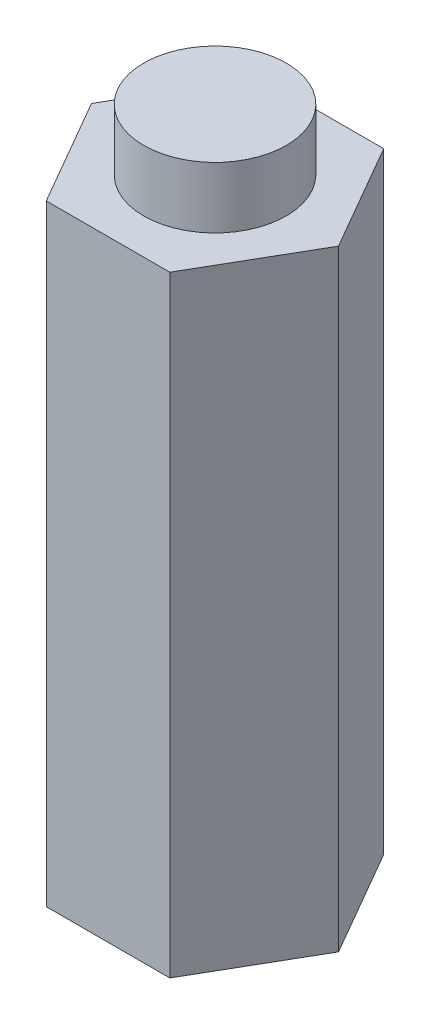
from build123d import *

# Parameters (mm, degrees)
DODANIE_WYCI_GNI_CIE1_DEPTH = 60
SZKIC2_R                    = 7
DODANIE_WYCI_GNI_CIE2_DEPTH = 6


with BuildPart() as part:
    # Szkic1 → Dodanie-wyciągnięcie1 (new body)
    with BuildSketch(Plane(origin=(0, 0, 0), x_dir=(1, 0, 0), z_dir=(0, 1, 0))):
        Polygon((12.124355653, 0), (6.062177826, 10.5), (-6.062177826, 10.5), (-12.124355653, 0), (-6.062177826, -10.5), (6.062177826, -10.5), align=None)
    extrude(amount=DODANIE_WYCI_GNI_CIE1_DEPTH)

    # Szkic2 → Dodanie-wyciągnięcie2 (add)
    with BuildSketch(Plane(origin=(0, 60, 0), x_dir=(1, 0, 0), z_dir=(0, 1, 0))):
        with Locations(Location((0, 0, 0), (0, 0, 270))):
            Circle(SZKIC2_R)
    extrude(amount=DODANIE_WYCI_GNI_CIE2_DEPTH)


solid = part.part
